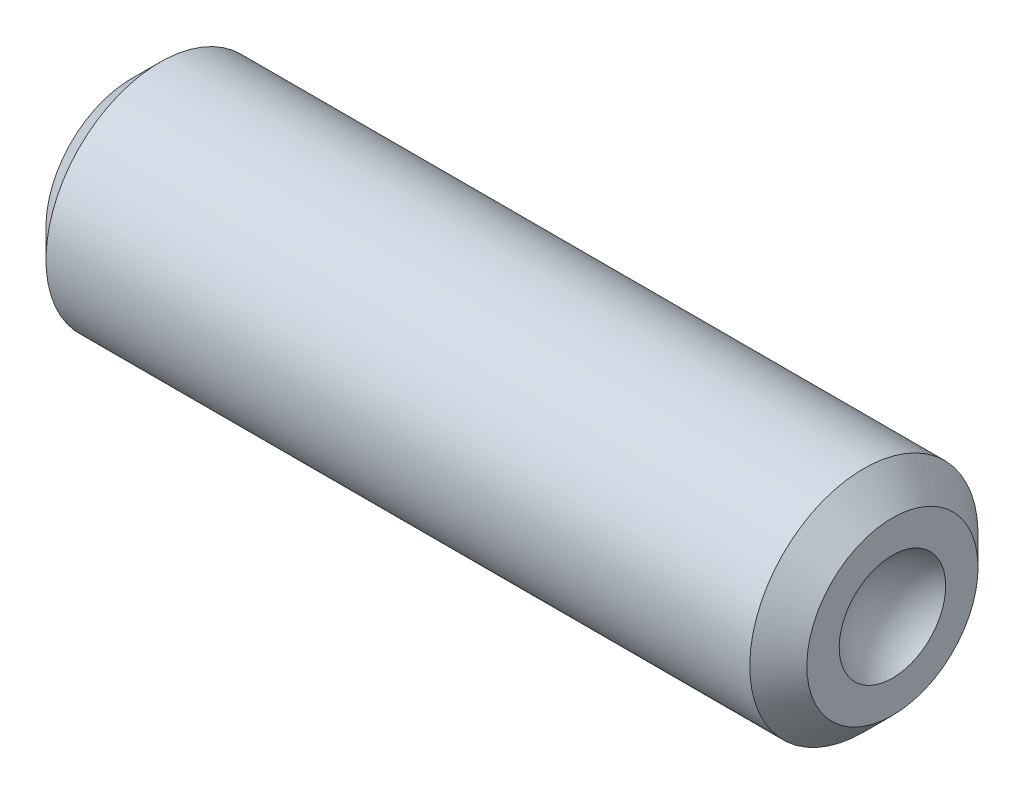
from build123d import *

# Parameters (mm, degrees)
CUT_EXTRUDE1_DEPTH = 8


with BuildPart() as part:
    # Sketch1 → Revolve1 (revolve)
    with BuildSketch(Plane.XY, mode=Mode.PRIVATE) as revolve1_sk:
        with BuildLine():
            Line((0, 0), (0, 1.125))
            Line((0, 1.125), (0.375, 1.5))
            Line((0.375, 1.5), (9.625, 1.5))
            Line((9.625, 1.5), (10, 1.125))
            Line((10, 1.125), (10, 0.7))
            ThreePointArc((10, 0.7), (9.724655592, 0.397059504), (9.625, 0))
            Line((9.625, 0), (0, 0))
        make_face()
    revolve(revolve1_sk.sketch.rotate(Axis((0, 0, 0), (1, 0, 0)), 180), axis=Axis((0, 0, 0), (1, 0, 0)))

    # Sketch2 → Cut-Extrude1 (cut)
    with BuildSketch(Plane.ZY):
        Polygon((0, 0.866025404), (-0.75, 0.433012702), (-0.75, -0.433012702), (0, -0.866025404), (0.75, -0.433012702), (0.75, 0.433012702), align=None)
    extrude(amount=-CUT_EXTRUDE1_DEPTH, mode=Mode.SUBTRACT)


solid = part.part
